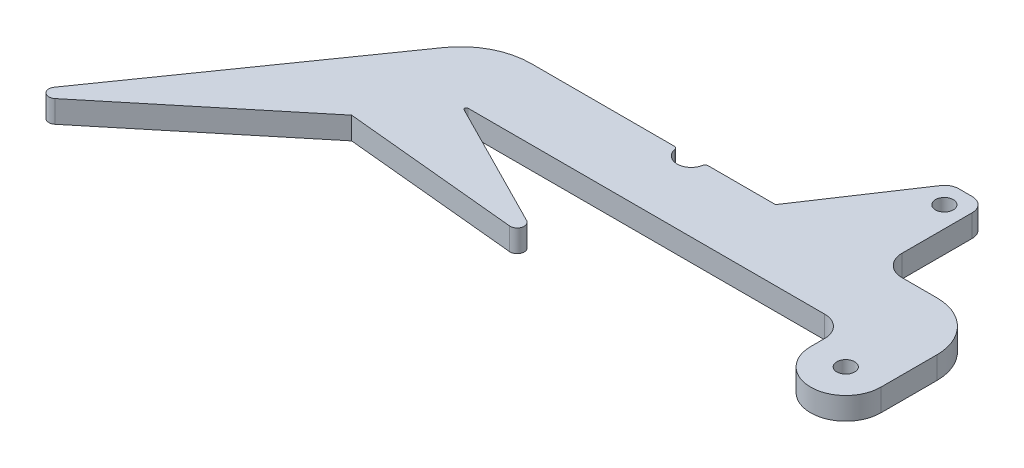
from build123d import *

# Parameters (mm, degrees)
BOSS_EXTRUDE1_DEPTH = 3.175
CUT_EXTRUDE1_REACH  = 105.449
SKETCH2_R           = 1.27
CUT_EXTRUDE2_DEPTH  = 104.449433541
FILLET1_R           = 10
FILLET2_R           = 0.25
FILLET3_R           = 3
FILLET4_R           = 0.5
FILLET5_R           = 7
FILLET6_R           = 3


with BuildPart() as part:
    # Sketch1 → Boss-Extrude1 (new body)
    with BuildSketch(Plane(origin=(0, 0, 0), x_dir=(1, 0, 0), z_dir=(0, 1, 0))):
        with BuildLine():
            Line((-30, 0), (-70, 0))
            Line((-70, 0), (-95.810939636, -36.861841993))
            ThreePointArc((-95.810939636, -36.861841993), (-95.670834686, -38.169513139), (-94.356227321, -38.207469686))
            Line((-94.356227321, -38.207469686), (-71.194689629, -19.140661569))
            Line((-71.194689629, -19.140661569), (-46.31139823, -21.55350411))
            ThreePointArc((-46.31139823, -21.55350411), (-45.254748427, -20.8377054), (-45.762041851, -19.666582016))
            Line((-45.762041851, -19.666582016), (-64.794329494, -10))
            Line((-64.794329494, -10), (-10, -10))
            Line((-10, -10), (-10, -15))
            ThreePointArc((-10, -15), (-5, -20), (0, -15))
            Line((0, -15), (0, 0))
            Line((0, 0), (-15, 0))
            Line((-15, 0), (-15, 13))
            ThreePointArc((-15, 13), (-15.585786438, 14.414213562), (-17, 15))
            Line((-17, 15), (-18.929632483, 15))
            ThreePointArc((-18.929632483, 15), (-19.873348334, 14.763349198), (-20.593733072, 14.109400392))
            Line((-20.593733072, 14.109400392), (-30, 0))
        make_face()
    extrude(amount=BOSS_EXTRUDE1_DEPTH)

    # Sketch2 → Cut-Extrude1 (cut, up to next)
    with BuildSketch(Plane(origin=(0, 3.175, 0), x_dir=(1, 0, 0), z_dir=(0, 1, 0)), mode=Mode.PRIVATE) as cut_extrude1_sk1:
        with Locations(Location((-5, -15, 0), (0, 0, 270))):
            Circle(SKETCH2_R)
    cut_extrude1_tool1 = extrude(cut_extrude1_sk1.sketch, amount=-CUT_EXTRUDE1_REACH, mode=Mode.PRIVATE) & part.part
    # Sketch2 → Cut-Extrude1 (cut, up to next)
    with BuildSketch(Plane(origin=(0, 3.175, 0), x_dir=(1, 0, 0), z_dir=(0, 1, 0)), mode=Mode.PRIVATE) as cut_extrude1_sk2:
        with Locations(Location((-17.964816242, 12, 0), (0, 0, 270))):
            Circle(SKETCH2_R)
    cut_extrude1_tool2 = extrude(cut_extrude1_sk2.sketch, amount=-CUT_EXTRUDE1_REACH, mode=Mode.PRIVATE) & part.part
    add(cut_extrude1_tool1.solids().sort_by_distance((-5, 3.175, 15))[0], mode=Mode.SUBTRACT)
    add(cut_extrude1_tool2.solids().sort_by_distance((-17.964816, 3.175, -12))[0], mode=Mode.SUBTRACT)

    # Sketch3 → Cut-Extrude2 (cut, through all)
    with BuildSketch(Plane(origin=(0, 3.175, 0), x_dir=(1, 0, 0), z_dir=(0, 1, 0))):
        with BuildLine():
            Line((-44, 0), (-40, 0))
            ThreePointArc((-40, 0), (-42, -2), (-44, 0))
        make_face()
    extrude(amount=-CUT_EXTRUDE2_DEPTH, mode=Mode.SUBTRACT)

    # Fillet1
    fillet1_edges = [part.edges().sort_by_distance(p)[0] for p in [
        (-70, 1.5875, 0),
    ]]
    fillet(fillet1_edges, radius=FILLET1_R)

    # Fillet2
    fillet2_edges = [part.edges().sort_by_distance(p)[0] for p in [
        (-64.794329494, 1.5875, 10),
    ]]
    fillet(fillet2_edges, radius=FILLET2_R)

    # Fillet3
    fillet3_edges = [part.edges().sort_by_distance(p)[0] for p in [
        (-10, 1.5875, 10),
    ]]
    fillet(fillet3_edges, radius=FILLET3_R)

    # Fillet4
    fillet4_edges = [part.edges().sort_by_distance(p)[0] for p in [
        (-40, 1.5875, 0),
        (-44, 1.5875, 0),
    ]]
    fillet(fillet4_edges, radius=FILLET4_R)

    # Fillet5
    fillet5_edges = [part.edges().sort_by_distance(p)[0] for p in [
        (0, 1.5875, 0),
    ]]
    fillet(fillet5_edges, radius=FILLET5_R)

    # Fillet6
    fillet6_edges = [part.edges().sort_by_distance(p)[0] for p in [
        (-15, 1.5875, 0),
    ]]
    fillet(fillet6_edges, radius=FILLET6_R)


solid = part.part
